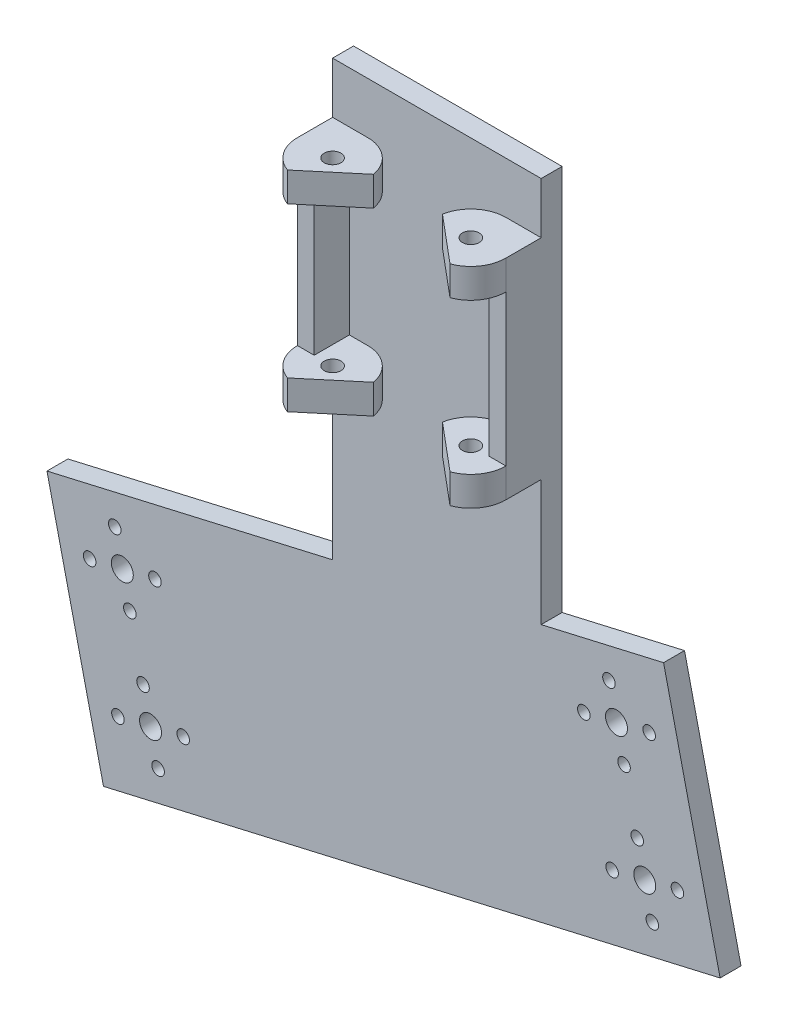
from build123d import *

# Parameters (mm, degrees)
BOSS_EXTRUDE2_DEPTH     = 7
CUT_EXTRUDE2_DEPTH      = 30.130224853
CUT_EXTRUDE2_DEPTH_BACK = 30.130224853
SKETCH3_R               = 2
BOSS_EXTRUDE3_DEPTH     = 36
SKETCH5_R               = 2
BOSS_EXTRUDE4_DEPTH     = 7
SKETCH13_W              = 49.8
SKETCH13_H              = 5
BOSS_EXTRUDE6_DEPTH     = 12.25
SKETCH15_W              = 49.8
SKETCH15_H              = 5
BOSS_EXTRUDE7_DEPTH     = 30
BOSS_EXTRUDE8_DEPTH     = 5
CUT_EXTRUDE3_DEPTH      = 150.404134049
CUT_EXTRUDE3_DEPTH_BACK = 150.404134049
SKETCH16_R              = 2.625
SKETCH16_R_2            = 1.5


with BuildPart() as part:
    # Sketch1 → Boss-Extrude2 (new body)
    with BuildSketch(Plane(origin=(0, 0, 0), x_dir=(1, 0, 0), z_dir=(0, 1, 0))):
        with BuildLine():
            Line((-24.9, 0), (-24.9, 13.4))
            Line((-24.9, 13.4), (24.9, 13.4))
            Line((24.9, 13.4), (24.9, 0))
            ThreePointArc((24.9, 0), (23.392904185, -4.800819919), (19.412411454, -7.878950407))
            Line((19.412411454, -7.878950407), (8.235013612, 1.5))
            ThreePointArc((8.235013612, 1.5), (11.116692467, 6.448255578), (16.5, 8.4))
            Line((16.5, 8.4), (-16.5, 8.4))
            ThreePointArc((-16.5, 8.4), (-11.116692467, 6.448255578), (-8.235013612, 1.5))
            Line((-8.235013612, 1.5), (-19.412411454, -7.878950407))
            ThreePointArc((-19.412411454, -7.878950407), (-23.392904185, -4.800819919), (-24.9, 0))
        make_face()
    extrude(amount=BOSS_EXTRUDE2_DEPTH)

    # Sketch3 → Cut-Extrude2 (cut, two sides: drawn at the far end of the back side and taken through both)
    with BuildSketch(Plane(origin=(0, 7, 0), x_dir=(1, 0, 0), z_dir=(0, 1, 0)).offset(-CUT_EXTRUDE2_DEPTH_BACK)):
        with Locations(Location((-16.5, 0, 0), (0, 0, 270))):
            Circle(SKETCH3_R)
        with Locations(Location((16.5, 0, 0), (0, 0, 270))):
            Circle(SKETCH3_R)
    extrude(amount=CUT_EXTRUDE2_DEPTH + CUT_EXTRUDE2_DEPTH_BACK, mode=Mode.SUBTRACT)

    # Sketch4 → Boss-Extrude3 (add)
    with BuildSketch(Plane(origin=(0, 7, 0), x_dir=(1, 0, 0), z_dir=(0, 1, 0))):
        Polygon((-24.9, 13.4), (-24.9, 0), (-20.9, 0), (-20.9, 8.4), (-16.5, 8.4), (16.5, 8.4), (20.9, 8.4), (20.9, 0), (24.9, 0), (24.9, 13.4), align=None)
    extrude(amount=BOSS_EXTRUDE3_DEPTH)

    # Sketch5 → Boss-Extrude4 (add)
    with BuildSketch(Plane(origin=(0, 43, 0), x_dir=(1, 0, 0), z_dir=(0, 1, 0))):
        with BuildLine():
            Line((-24.9, 13.4), (-24.9, 0))
            ThreePointArc((-24.9, 0), (-23.392904185, -4.800819919), (-19.412411454, -7.878950407))
            Line((-19.412411454, -7.878950407), (-8.235013612, 1.5))
            ThreePointArc((-8.235013612, 1.5), (-11.116692467, 6.448255578), (-16.5, 8.4))
            Line((-16.5, 8.4), (16.5, 8.4))
            ThreePointArc((16.5, 8.4), (11.116692467, 6.448255578), (8.235013612, 1.5))
            Line((8.235013612, 1.5), (19.412411454, -7.878950407))
            ThreePointArc((19.412411454, -7.878950407), (23.392904185, -4.800819919), (24.9, 0))
            Line((24.9, 0), (24.9, 13.4))
            Line((24.9, 13.4), (-24.9, 13.4))
        make_face()
        with Locations(Location((16.5, 0, 0), (0, 0, 270))):
            Circle(SKETCH5_R, mode=Mode.SUBTRACT)
        with Locations(Location((-16.5, 0, 0), (0, 0, 270))):
            Circle(SKETCH5_R, mode=Mode.SUBTRACT)
    extrude(amount=BOSS_EXTRUDE4_DEPTH)

    # Sketch13 → Boss-Extrude6 (add)
    with BuildSketch(Plane(origin=(0, 50, 0), x_dir=(1, 0, 0), z_dir=(0, 1, 0))):
        with Locations((0, 10.9)):
            Rectangle(SKETCH13_W, SKETCH13_H)
    extrude(amount=BOSS_EXTRUDE6_DEPTH)

    # Sketch15 → Boss-Extrude7 (add)
    with BuildSketch(Plane.XZ):
        with Locations((0, -10.9)):
            Rectangle(SKETCH15_W, SKETCH15_H)
    extrude(amount=BOSS_EXTRUDE7_DEPTH)

    # Sketch12 → Boss-Extrude8 (add)
    with BuildSketch(Plane(origin=(0, 0, -13.4), x_dir=(-1, 0, 0), z_dir=(0, 0, -1))):
        Polygon((24.9, -30), (24.9, -41.497235918), (93.105904535, -57.243809722), (79.608841274, -115.706013609), (-67.628165204, -81.713672257), (-54.131101944, -23.25146837), (-24.9, -30), align=None)
    extrude(amount=-BOSS_EXTRUDE8_DEPTH)

    # Sketch16 → Cut-Extrude3 (cut, two sides: drawn at the far end of the back side and taken through both)
    with BuildSketch(Plane.XY.offset(-8.4).offset(-CUT_EXTRUDE3_DEPTH_BACK)):
        with Locations((42.889816787, -41.241285157)):
            Circle(SKETCH16_R)
        with Locations((50.684777305, -39.441676722)):
            Circle(SKETCH16_R_2)
        with Locations((44.689425222, -49.036245675)):
            Circle(SKETCH16_R_2)
        with Locations((35.094856269, -43.040893591)):
            Circle(SKETCH16_R_2)
        with Locations((41.090208352, -33.446324638)):
            Circle(SKETCH16_R_2)
        with Locations((-82.911048266, -70.284703313)):
            Circle(SKETCH16_R_2)
        with Locations((-76.915696183, -60.69013436)):
            Circle(SKETCH16_R_2)
        with Locations((-67.32112723, -66.685486444)):
            Circle(SKETCH16_R_2)
        with Locations((-73.316479313, -76.280055397)):
            Circle(SKETCH16_R_2)
        with Locations((-75.116087748, -68.485094879)):
            Circle(SKETCH16_R)
        with Locations(Location((47.838739983, -62.677426582, 0), (0, 0, 180))):
            Circle(SKETCH16_R_2)
        with Locations(Location((57.433308936, -68.672778665, 0), (0, 0, 180))):
            Circle(SKETCH16_R_2)
        with Locations(Location((51.437956852, -78.267347618, 0), (0, 0, 180))):
            Circle(SKETCH16_R_2)
        with Locations(Location((49.638348417, -70.4723871, 0), (0, 0, 180))):
            Circle(SKETCH16_R)
        with Locations(Location((41.843387899, -72.271995535, 0), (0, 0, 180))):
            Circle(SKETCH16_R_2)
        with Locations(Location((-70.167164552, -89.921236304, 0), (0, 0, 180))):
            Circle(SKETCH16_R_2)
        with Locations(Location((-68.367556118, -97.716196822, 0), (0, 0, 180))):
            Circle(SKETCH16_R)
        with Locations(Location((-76.162516636, -99.515805257, 0), (0, 0, 180))):
            Circle(SKETCH16_R_2)
        with Locations(Location((-66.567947683, -105.511157341, 0), (0, 0, 180))):
            Circle(SKETCH16_R_2)
        with Locations(Location((-60.572595599, -95.916588388, 0), (0, 0, 180))):
            Circle(SKETCH16_R_2)
    extrude(amount=CUT_EXTRUDE3_DEPTH + CUT_EXTRUDE3_DEPTH_BACK, mode=Mode.SUBTRACT)


solid = part.part
